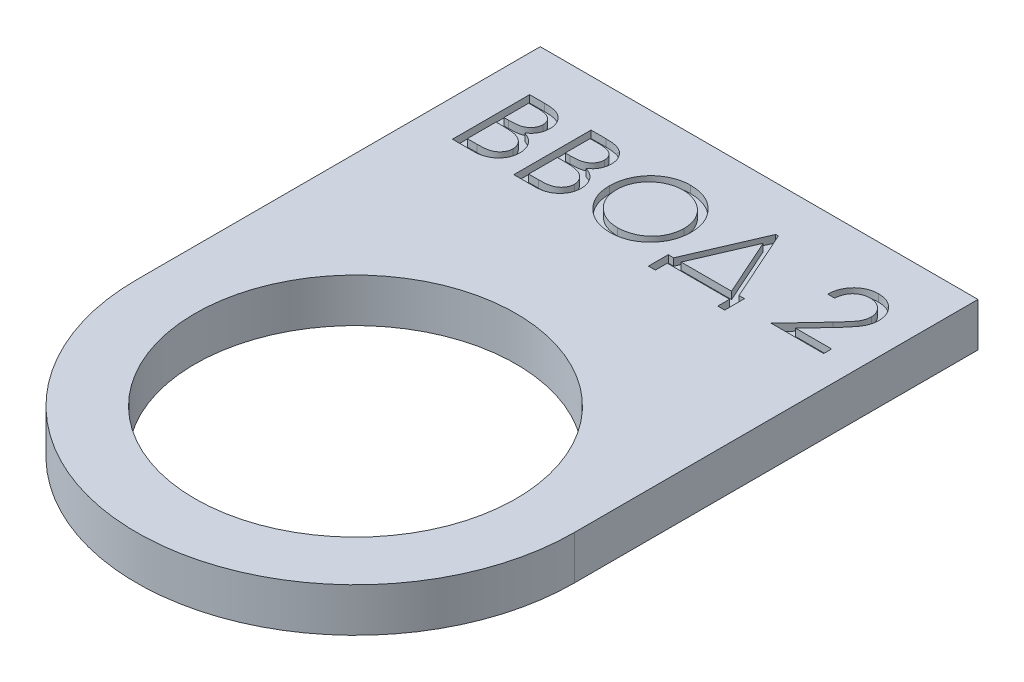
from build123d import *

# Parameters (mm, degrees)
SKETCH1_R           = 11
BOSS_EXTRUDE1_DEPTH = 1.5
CUT_EXTRUDE1_DEPTH  = 0.5


with BuildPart() as part:
    # Sketch1 → Boss-Extrude1 (new, symmetric)
    with BuildSketch(Plane(origin=(0, 0, 0), x_dir=(1, 0, 0), z_dir=(0, 1, 0))):
        with BuildLine():
            Line((15, 17.5), (-15, 17.5))
            Line((-15, 17.5), (-15, -10.16226942))
            ThreePointArc((-15, -10.16226942), (0, -25.16226942), (15, -10.16226942))
            Line((15, -10.16226942), (15, 17.5))
        make_face()
        with Locations(Location((0, -10.16226942, 0), (0, 0, 270))):
            Circle(SKETCH1_R, mode=Mode.SUBTRACT)
    extrude(amount=BOSS_EXTRUDE1_DEPTH, both=True)

    # Sketch2 → Cut-Extrude1 (cut)
    # profile 1 of 5: a face of its own
    with BuildSketch(Plane(origin=(0, 1.5, 0), x_dir=(1, 0, 0), z_dir=(0, 1, 0))):
        with BuildLine():
            Line((10.00667735, 12.663461538), (9.531784188, 12.663461538))
            add(Edge.make_bspline(
                [(9.531784188, 12.663461538), (9.534879288, 12.726463952), (9.540957983, 12.850199016), (9.569424563, 13.030605398), (9.610156604, 13.203045391), (9.667747255, 13.366134428), (9.739269841, 13.521314529), (9.82504024, 13.667969315), (9.926630942, 13.805539327), (10.041848266, 13.932749244), (10.166986566, 14.0494495), (10.302008641, 14.150225879), (10.443893385, 14.235372835), (10.592210333, 14.306555188), (10.748632852, 14.35998567), (10.911741458, 14.399630292), (11.082252772, 14.423482624), (11.198427567, 14.42604649), (11.257512019, 14.427350427)],
                knots=[0, 0, 0, 0, 1.10065271, 2.161652631, 3.183658789, 4.190468796, 5.17591951, 6.163126047, 7.15150782, 8.156236427, 9.156009102, 10.134482811, 11.092018607, 12.041330605, 13.001268258, 13.972401359, 14.968799086, 16, 16, 16, 16], degree=3))
            add(Edge.make_bspline(
                [(11.257512019, 14.427350427), (11.315536012, 14.425992047), (11.429551086, 14.423322877), (11.595954369, 14.400400845), (11.75436766, 14.364499772), (11.904481307, 14.314130035), (12.045097619, 14.246420246), (12.177272936, 14.165083492), (12.302580829, 14.071013032), (12.41537918, 13.960260243), (12.518956871, 13.842025685), (12.608313852, 13.715799926), (12.684836135, 13.585429459), (12.748619889, 13.449920154), (12.795573814, 13.307996099), (12.831221819, 13.161723542), (12.851371599, 13.009588411), (12.854464084, 12.906617786), (12.856036325, 12.854266827)],
                knots=[0, 0, 0, 0, 1.111607364, 2.184268762, 3.212621178, 4.221274766, 5.211760367, 6.196651075, 7.1921475, 8.207485113, 9.220403448, 10.201281604, 11.166441695, 12.114753415, 13.065576456, 14.026450734, 14.996634279, 16, 16, 16, 16], degree=3))
            add(Edge.make_bspline(
                [(12.856036325, 12.854266827), (12.853476273, 12.780564744), (12.848401094, 12.634453944), (12.804987691, 12.419740997), (12.737184037, 12.211712852), (12.655545176, 12.044288597), (12.573188029, 11.909376053), (12.498972392, 11.798298368), (12.412091071, 11.678698434), (12.311279532, 11.550976745), (12.198623166, 11.414132877), (12.073101562, 11.268249496), (11.933819631, 11.114833844), (11.836062135, 11.010050375), (11.785406651, 10.955754207)],
                knots=[0, 0, 0, 0, 1.184426356, 2.348067706, 3.509069118, 4.696110526, 5.333549288, 6.050745305, 6.844228056, 7.710549037, 8.667450064, 9.695053472, 10.805634456, 12, 12, 12, 12], degree=3))
            Line((11.785406651, 10.955754207), (10.461429955, 9.542735043))
            Line((10.461429955, 9.542735043), (12.923878205, 9.542735043))
            Line((12.923878205, 9.542735043), (12.923878205, 9))
            Line((12.923878205, 9), (9.328258547, 9))
            Line((9.328258547, 9), (11.380475427, 11.1900207))
            add(Edge.make_bspline(
                [(11.380475427, 11.1900207), (11.430440685, 11.242178854), (11.526413719, 11.342363993), (11.662156424, 11.488630135), (11.784074894, 11.624322893), (11.892958334, 11.749185889), (11.986444705, 11.865045521), (12.069406294, 11.968149418), (12.13587808, 12.063028171), (12.208019214, 12.173005051), (12.277890352, 12.307280816), (12.337931653, 12.471373418), (12.374542197, 12.640294383), (12.378934032, 12.754446273), (12.381143162, 12.811865652)],
                knots=[0, 0, 0, 0, 1.329631726, 2.553950428, 3.673215718, 4.687767853, 5.603093632, 6.413772471, 7.123043292, 7.734684054, 8.834405432, 9.900288307, 10.943827018, 12, 12, 12, 12], degree=3))
            add(Edge.make_bspline(
                [(12.381143162, 12.811865652), (12.380181981, 12.847972052), (12.378287676, 12.919130833), (12.36156949, 13.023460968), (12.336304797, 13.124100627), (12.300101847, 13.221359373), (12.252315466, 13.314259347), (12.19414738, 13.402913632), (12.127033831, 13.488621949), (12.049395603, 13.568984673), (11.964106757, 13.64258602), (11.874005928, 13.70778553), (11.778680175, 13.762273233), (11.678531419, 13.806940187), (11.573838864, 13.841979156), (11.464400023, 13.866258199), (11.350517284, 13.881501954), (11.272754737, 13.883564452), (11.233131343, 13.884615385)],
                knots=[0, 0, 0, 0, 0.991446411, 1.95395049, 2.89581595, 3.838931463, 4.798493298, 5.75982156, 6.748411868, 7.785213223, 8.824556874, 9.840280684, 10.836137867, 11.835679398, 12.848801643, 13.863922112, 14.911575587, 16, 16, 16, 16], degree=3))
            add(Edge.make_bspline(
                [(11.233131343, 13.884615385), (11.191749251, 13.883534324), (11.110481654, 13.881411299), (10.991163593, 13.866560367), (10.877338667, 13.84093987), (10.768720552, 13.805898946), (10.665125464, 13.761360425), (10.567057207, 13.705886002), (10.474735934, 13.63968953), (10.387988095, 13.564637737), (10.308062793, 13.481078387), (10.23783954, 13.387929991), (10.176480376, 13.286893303), (10.122944988, 13.178240947), (10.079469123, 13.060987018), (10.046247812, 12.93554775), (10.019960556, 12.802467804), (10.011178626, 12.710566545), (10.00667735, 12.663461538)],
                knots=[0, 0, 0, 0, 1.031018746, 2.02475058, 2.990194455, 3.934040569, 4.864654155, 5.795059489, 6.735614925, 7.690564532, 8.649604399, 9.611025574, 10.590972636, 11.591080095, 12.624614302, 13.701020113, 14.821632451, 16, 16, 16, 16], degree=3))
        make_face()
    # profile 2 of 5: a face of its own
    with BuildSketch(Plane(origin=(0, 1.5, 0), x_dir=(1, 0, 0), z_dir=(0, 1, 0))):
        Polygon((2.204861111, 8.185897436), (1.729967949, 8.185897436), (1.729967949, 9.542735043), (2.103098291, 9.542735043), (4.211496728, 14.427350427), (4.393821782, 14.427350427), (6.580662393, 9.542735043), (6.953792735, 9.542735043), (6.953792735, 8.185897436), (6.478899573, 8.185897436), (6.478899573, 9), (2.204861111, 9), align=None)
        Polygon((2.612972423, 9.542735043), (6.067608173, 9.542735043), (4.307959402, 13.472263956), align=None, mode=Mode.SUBTRACT)
    # profile 3 of 5: a face of its own
    with BuildSketch(Plane(origin=(0, 1.5, 0), x_dir=(1, 0, 0), z_dir=(0, 1, 0))):
        with BuildLine():
            add(Edge.make_bspline(
                [(-1.628205128, 14.427350427), (-1.530221444, 14.424868667), (-1.337773405, 14.419994285), (-1.054933976, 14.38268183), (-0.784915201, 14.318130467), (-0.525517491, 14.232159053), (-0.279843586, 14.117474446), (-0.046044308, 13.978855234), (0.17532406, 13.81484916), (0.381277816, 13.626724019), (0.569747253, 13.42203713), (0.735793533, 13.20360029), (0.874952715, 12.972734244), (0.989231227, 12.73013275), (1.078885077, 12.476344465), (1.140750774, 12.210016389), (1.180269168, 11.932874132), (1.184889212, 11.74384542), (1.187232906, 11.647953392)],
                knots=[0, 0, 0, 0, 1.065120563, 2.091984664, 3.0946048, 4.079830382, 5.057816894, 6.036188127, 7.030412546, 8.04752943, 9.064399622, 10.05169764, 11.02544977, 11.989514704, 12.962713494, 13.945757189, 14.957906945, 16, 16, 16, 16], degree=3))
            add(Edge.make_bspline(
                [(1.187232906, 11.647953392), (1.184889556, 11.552767729), (1.180270541, 11.36514576), (1.140705841, 11.08976222), (1.078655758, 10.825041762), (0.990063784, 10.571426311), (0.876330025, 10.328648327), (0.73624423, 10.097346623), (0.571233114, 9.87744537), (0.383444185, 9.671353602), (0.178730705, 9.482369331), (-0.040843627, 9.317694364), (-0.270340671, 9.175992414), (-0.512713682, 9.062926621), (-0.764748261, 8.97255717), (-1.028700107, 8.910943074), (-1.303332397, 8.871199569), (-1.490613557, 8.86663586), (-1.585803953, 8.864316239)],
                knots=[0, 0, 0, 0, 1.043624062, 2.057103931, 3.04512605, 4.022047818, 4.998200453, 5.980619268, 6.982898556, 8.009068085, 9.034988726, 10.034168286, 11.015286542, 11.987931943, 12.962482838, 13.94673481, 14.956375938, 16, 16, 16, 16], degree=3))
            add(Edge.make_bspline(
                [(-1.585803953, 8.864316239), (-1.681695483, 8.866658765), (-1.870723214, 8.871276506), (-2.148213732, 8.910860296), (-2.414728892, 8.972759649), (-2.669506542, 9.061220344), (-2.912688757, 9.175546395), (-3.144751144, 9.314950635), (-3.364762236, 9.480363812), (-3.570897972, 9.668091848), (-3.759506878, 9.872458361), (-3.923940696, 10.091433961), (-4.063376284, 10.320722568), (-4.177318466, 10.560960491), (-4.267525446, 10.810986363), (-4.329067254, 11.07246799), (-4.368884706, 11.343914624), (-4.373473104, 11.528734244), (-4.375801282, 11.622512687)],
                knots=[0, 0, 0, 0, 1.053102029, 2.075944431, 3.073151272, 4.055350789, 5.033113405, 6.020478099, 7.024410459, 8.052272461, 9.079885166, 10.07527673, 11.055994387, 12.023226415, 12.992069828, 13.970394897, 14.97016774, 16, 16, 16, 16], degree=3))
            add(Edge.make_bspline(
                [(-4.375801282, 11.622512687), (-4.374992964, 11.685457318), (-4.373386525, 11.810552504), (-4.354046705, 11.996315102), (-4.32598318, 12.179090263), (-4.285763622, 12.358358244), (-4.233161935, 12.533680209), (-4.171095179, 12.706265291), (-4.095288508, 12.874364493), (-4.009592767, 13.038774144), (-3.913946938, 13.196931335), (-3.80830146, 13.346427848), (-3.696367033, 13.488518164), (-3.573655712, 13.619520182), (-3.444211801, 13.743244877), (-3.305935443, 13.85779089), (-3.159670384, 13.964191113), (-3.004787262, 14.060076629), (-2.845102489, 14.146798177), (-2.68049117, 14.221216928), (-2.513188973, 14.28508895), (-2.342412303, 14.336857817), (-2.168614659, 14.377727681), (-1.991416723, 14.405557846), (-1.810959662, 14.424946994), (-1.689385406, 14.426545836), (-1.628205128, 14.427350427)],
                knots=[0, 0, 0, 0, 1.037015668, 2.060948919, 3.074880161, 4.083647147, 5.086022904, 6.090072063, 7.104153813, 8.122640571, 9.144368836, 10.147691507, 11.138137339, 12.123020368, 13.103399296, 14.087645067, 15.080126199, 16.082011238, 17.087798457, 18.072939717, 19.057185487, 20.037253025, 21.01195951, 21.997135196, 22.992090687, 24, 24, 24, 24], degree=3))
        make_face()
        with BuildLine():
            add(Edge.make_bspline(
                [(-1.604884482, 13.884615385), (-1.655101844, 13.884003229), (-1.755056488, 13.88278477), (-1.903653347, 13.866734819), (-2.050295913, 13.843859868), (-2.195014473, 13.811230664), (-2.337203506, 13.766774537), (-2.478188384, 13.715610307), (-2.616683478, 13.653287943), (-2.752231572, 13.58287445), (-2.883638888, 13.504937391), (-3.007634282, 13.418801505), (-3.124538756, 13.326486786), (-3.234066076, 13.227777794), (-3.335894634, 13.122171848), (-3.432028647, 13.011269951), (-3.5186148, 12.891902211), (-3.597967993, 12.767305524), (-3.668978895, 12.637642181), (-3.732124133, 12.504277271), (-3.783776861, 12.366122911), (-3.82590212, 12.224677934), (-3.860826834, 12.080166359), (-3.882951934, 11.93149192), (-3.899178239, 11.779401692), (-3.900327053, 11.676619603), (-3.90090812, 11.624632746)],
                knots=[0, 0, 0, 0, 1.008559885, 2.007477868, 2.99961109, 3.989939068, 4.984837346, 5.991145699, 7.001802488, 8.033829008, 9.059044045, 10.069351652, 11.065060232, 12.050310815, 13.029377138, 14.011219647, 14.996725999, 15.989392538, 16.977580475, 17.965360261, 18.951710183, 19.937753436, 20.929683414, 21.935841486, 22.955955122, 24, 24, 24, 24], degree=3))
            add(Edge.make_bspline(
                [(-3.90090812, 11.624632746), (-3.89898065, 11.548187483), (-3.89518872, 11.397796003), (-3.861990965, 11.177408452), (-3.810855361, 10.965608305), (-3.735475772, 10.763554466), (-3.64120758, 10.569510134), (-3.524750258, 10.38519669), (-3.386775212, 10.21056432), (-3.230045833, 10.046832187), (-3.058712693, 9.897386745), (-2.876781065, 9.766208734), (-2.686200016, 9.655219428), (-2.486472555, 9.564799854), (-2.278664966, 9.493151084), (-2.061438192, 9.444046487), (-1.836239283, 9.411728834), (-1.682734602, 9.408625263), (-1.604884482, 9.407051282)],
                knots=[0, 0, 0, 0, 1.032063989, 2.030389145, 3.003944642, 3.970395727, 4.937377036, 5.913328081, 6.909231446, 7.93887556, 8.970685674, 9.976071282, 10.964166581, 11.944589148, 12.933237628, 13.927779006, 14.949070134, 16, 16, 16, 16], degree=3))
            add(Edge.make_bspline(
                [(-1.604884482, 9.407051282), (-1.552558212, 9.407770199), (-1.448779502, 9.409196028), (-1.294420795, 9.423557123), (-1.142842951, 9.446586259), (-0.994258576, 9.479743322), (-0.848836302, 9.521240884), (-0.705969159, 9.570540663), (-0.567178886, 9.632046768), (-0.430714608, 9.70000379), (-0.300091719, 9.777474029), (-0.175396569, 9.860686469), (-0.059772171, 9.952865217), (0.049673211, 10.050107624), (0.151919836, 10.154374394), (0.246276277, 10.265529968), (0.33242481, 10.384275961), (0.411747871, 10.508683658), (0.482509947, 10.638701802), (0.544164061, 10.772550244), (0.596470093, 10.909899397), (0.638695332, 11.050947368), (0.671784066, 11.195426271), (0.694583469, 11.343529556), (0.710531703, 11.494960942), (0.711733784, 11.597383201), (0.712339744, 11.649013421)],
                knots=[0, 0, 0, 0, 1.047197238, 2.076906641, 3.100256066, 4.114471768, 5.12198147, 6.126382909, 7.136867548, 8.15857795, 9.17633901, 10.174870724, 11.156907918, 12.133735059, 13.104061851, 14.077631395, 15.04955518, 16.038496417, 17.029181396, 18.010275684, 18.986308667, 19.968651475, 20.955262928, 21.950658345, 22.966943676, 24, 24, 24, 24], degree=3))
            add(Edge.make_bspline(
                [(0.712339744, 11.649013421), (0.711733299, 11.700290434), (0.710530304, 11.802007834), (0.694591087, 11.952383118), (0.671759979, 12.099420712), (0.638856837, 12.242543367), (0.596447676, 12.381787565), (0.544154926, 12.517022529), (0.482491438, 12.648752062), (0.41172186, 12.776650582), (0.332171746, 12.899379055), (0.245245926, 13.016706512), (0.149443555, 13.126429586), (0.047501826, 13.23125704), (-0.063125584, 13.328953135), (-0.181937552, 13.419550279), (-0.307491684, 13.505234872), (-0.44042929, 13.582531853), (-0.577625506, 13.653915276), (-0.718404942, 13.71507334), (-0.861172747, 13.767040711), (-1.00556587, 13.81136517), (-1.152799658, 13.843732073), (-1.301879257, 13.866755434), (-1.452598409, 13.882779184), (-1.553961373, 13.884001375), (-1.604884482, 13.884615385)],
                knots=[0, 0, 0, 0, 1.02996197, 2.043119294, 3.035359645, 4.018872909, 4.991431989, 5.957985074, 6.929999688, 7.912076566, 8.892894881, 9.867085534, 10.843653904, 11.817741046, 12.803660682, 13.806313499, 14.818574707, 15.856120519, 16.894564902, 17.924820532, 18.937903209, 19.946497019, 20.957711757, 21.963978472, 22.977135795, 24, 24, 24, 24], degree=3))
        make_face(mode=Mode.SUBTRACT)
    # profile 4 of 5: a face of its own
    with BuildSketch(Plane(origin=(0, 1.5, 0), x_dir=(1, 0, 0), z_dir=(0, 1, 0))):
        with BuildLine():
            Line((-8.310630342, 14.291666667), (-7.278161725, 14.291666667))
            add(Edge.make_bspline(
                [(-7.278161725, 14.291666667), (-7.22762105, 14.291400949), (-7.129660643, 14.290885921), (-6.98720982, 14.28289833), (-6.853786023, 14.272007068), (-6.729350558, 14.254725856), (-6.613960924, 14.233874002), (-6.507269377, 14.208622447), (-6.409615188, 14.178344115), (-6.293028075, 14.13019557), (-6.160100409, 14.058647447), (-6.016169506, 13.952922116), (-5.893094049, 13.823605178), (-5.786979022, 13.677732592), (-5.702613043, 13.517265413), (-5.64157851, 13.346028306), (-5.602937437, 13.166229958), (-5.598963495, 13.042793249), (-5.596955128, 12.980410323)],
                knots=[0, 0, 0, 0, 1.001505555, 1.941167018, 2.826882275, 3.653841531, 4.429895133, 5.150066043, 5.825578002, 6.45369114, 7.647487171, 8.808567382, 9.977351308, 11.170798116, 12.373658725, 13.556498008, 14.765093433, 16, 16, 16, 16], degree=3))
            add(Edge.make_bspline(
                [(-5.596955128, 12.980410323), (-5.59860797, 12.92197134), (-5.601855961, 12.807133228), (-5.632914657, 12.639169515), (-5.681538525, 12.479283743), (-5.749128604, 12.328059423), (-5.836973288, 12.188913365), (-5.941080508, 12.060723093), (-6.066684722, 11.948916138), (-6.160790572, 11.886409607), (-6.208592081, 11.854659121)],
                knots=[0, 0, 0, 0, 1.044552857, 2.05264487, 3.044412934, 4.028983338, 5.005914585, 5.980388656, 6.974128949, 8, 8, 8, 8], degree=3))
            add(Edge.make_bspline(
                [(-6.208592081, 11.854659121), (-6.148478101, 11.831579897), (-6.033465166, 11.787423623), (-5.875189885, 11.709355719), (-5.73882387, 11.624443957), (-5.623318661, 11.531716041), (-5.524534349, 11.431765815), (-5.438275735, 11.323127725), (-5.364674134, 11.204384603), (-5.301608166, 11.076774496), (-5.252397547, 10.941600431), (-5.215543501, 10.800130329), (-5.194426048, 10.652871478), (-5.191420924, 10.552654297), (-5.189903846, 10.502061632)],
                knots=[0, 0, 0, 0, 1.27268992, 2.434971085, 3.483601985, 4.442670788, 5.356604649, 6.2567628, 7.179492994, 8.113709626, 9.066344395, 10.018646069, 10.999752585, 12, 12, 12, 12], degree=3))
            add(Edge.make_bspline(
                [(-5.189903846, 10.502061632), (-5.191380744, 10.450404575), (-5.194286583, 10.348767869), (-5.21572535, 10.199459511), (-5.252024833, 10.05677358), (-5.302025257, 9.919787173), (-5.367282566, 9.788765303), (-5.446699845, 9.663559534), (-5.541392804, 9.545427868), (-5.647321189, 9.433057628), (-5.767158005, 9.332020378), (-5.896449682, 9.242038298), (-6.036824475, 9.168036514), (-6.185976894, 9.105873005), (-6.345580087, 9.058388312), (-6.514917362, 9.025167873), (-6.693842676, 9.002784067), (-6.816624085, 9.000943769), (-6.879590678, 9)],
                knots=[0, 0, 0, 0, 0.978564426, 1.925352924, 2.850884081, 3.763762016, 4.682927383, 5.618979971, 6.567305752, 7.547517671, 8.540179244, 9.531824382, 10.526200242, 11.540722885, 12.589160233, 13.674978461, 14.80764778, 16, 16, 16, 16], degree=3))
            Line((-6.879590678, 9), (-8.310630342, 9))
            Line((-8.310630342, 9), (-8.310630342, 14.291666667))
        make_face()
        with BuildLine():
            Line((-7.835737179, 13.748931624), (-7.835737179, 12.052884615))
            Line((-7.835737179, 12.052884615), (-7.516668336, 12.052884615))
            add(Edge.make_bspline(
                [(-7.516668336, 12.052884615), (-7.470027895, 12.053489261), (-7.379909059, 12.054657559), (-7.249401597, 12.058004186), (-7.1282602, 12.067375038), (-7.016693976, 12.076743196), (-6.914878615, 12.091975013), (-6.823039681, 12.11010596), (-6.73973585, 12.129281305), (-6.643670109, 12.161892315), (-6.534702675, 12.210088324), (-6.418538339, 12.284885029), (-6.316130271, 12.373973039), (-6.229653571, 12.476768898), (-6.158879086, 12.58995944), (-6.109721445, 12.711738653), (-6.076388051, 12.839071471), (-6.073377045, 12.926487163), (-6.071848291, 12.970870059)],
                knots=[0, 0, 0, 0, 1.156816544, 2.235205308, 3.236616184, 4.169592532, 5.011045266, 5.787822928, 6.49130361, 7.128639758, 8.301311294, 9.436451833, 10.541879658, 11.654887649, 12.756523258, 13.837046038, 14.901820046, 16, 16, 16, 16], degree=3))
            add(Edge.make_bspline(
                [(-6.071848291, 12.970870059), (-6.072643825, 13.000239975), (-6.074204352, 13.057852274), (-6.086984941, 13.141837607), (-6.108707345, 13.220825185), (-6.136608479, 13.295897471), (-6.17559852, 13.364707054), (-6.221505185, 13.429633076), (-6.276970455, 13.488464493), (-6.340103535, 13.543451711), (-6.412688, 13.592202366), (-6.494680548, 13.63489971), (-6.587190489, 13.669281599), (-6.688658734, 13.699392924), (-6.800647164, 13.720541893), (-6.921863453, 13.738160705), (-7.053300468, 13.747130446), (-7.144234135, 13.74831784), (-7.191239316, 13.748931624)],
                knots=[0, 0, 0, 0, 0.91205012, 1.789085906, 2.630437955, 3.453916878, 4.269457761, 5.079663411, 5.91843418, 6.774407191, 7.675494373, 8.627863946, 9.638891023, 10.736472738, 11.911756761, 13.175263542, 14.539845004, 16, 16, 16, 16], degree=3))
            Line((-7.191239316, 13.748931624), (-7.835737179, 13.748931624))
        make_face(mode=Mode.SUBTRACT)
        with BuildLine():
            Line((-7.835737179, 11.510149573), (-7.835737179, 9.542735043))
            Line((-7.835737179, 9.542735043), (-7.159438435, 9.542735043))
            add(Edge.make_bspline(
                [(-7.159438435, 9.542735043), (-7.111028868, 9.543315232), (-7.017725811, 9.544433471), (-6.883013237, 9.548084048), (-6.758155449, 9.556387845), (-6.643722196, 9.569459547), (-6.538477821, 9.583638869), (-6.443684865, 9.602705924), (-6.358574918, 9.624551377), (-6.259886381, 9.658318518), (-6.148756077, 9.710776277), (-6.028996806, 9.789870406), (-5.922519072, 9.884097311), (-5.832099215, 9.993152384), (-5.757996245, 10.111733081), (-5.704088592, 10.237440931), (-5.670840511, 10.368198812), (-5.666815565, 10.457350865), (-5.664797009, 10.502061632)],
                knots=[0, 0, 0, 0, 1.160039823, 2.235823828, 3.228722157, 4.157150951, 4.99529583, 5.772374946, 6.472645482, 7.099169577, 8.269452708, 9.405989375, 10.527446681, 11.663510218, 12.788923519, 13.866172445, 14.929861265, 16, 16, 16, 16], degree=3))
            add(Edge.make_bspline(
                [(-5.664797009, 10.502061632), (-5.665214452, 10.530021802), (-5.666042606, 10.585491141), (-5.678531869, 10.667006724), (-5.696695696, 10.745967271), (-5.720177744, 10.822587188), (-5.754376224, 10.895481221), (-5.794300406, 10.966091044), (-5.841111096, 11.034509995), (-5.91405168, 11.121009473), (-6.020145038, 11.220669719), (-6.170892186, 11.318244276), (-6.342300304, 11.396935603), (-6.466620442, 11.430347907), (-6.530841012, 11.447607839)],
                knots=[0, 0, 0, 0, 0.723448775, 1.435228256, 2.130040452, 2.821711965, 3.505591119, 4.210454504, 4.921174351, 5.648778258, 7.137944449, 8.670945889, 10.280296675, 12, 12, 12, 12], degree=3))
            add(Edge.make_bspline(
                [(-6.530841012, 11.447607839), (-6.556587383, 11.452831597), (-6.612410827, 11.464157782), (-6.703438954, 11.476113476), (-6.807361042, 11.486764936), (-6.924417058, 11.49464371), (-7.054755104, 11.502787651), (-7.19865354, 11.505954821), (-7.355524719, 11.509733464), (-7.464370329, 11.510007322), (-7.520908454, 11.510149573)],
                knots=[0, 0, 0, 0, 0.634451884, 1.375622551, 2.216452059, 3.157844607, 4.20941857, 5.370758133, 6.634282058, 8, 8, 8, 8], degree=3))
            Line((-7.520908454, 11.510149573), (-7.835737179, 11.510149573))
        make_face(mode=Mode.SUBTRACT)
    # profile 5 of 5: a face of its own
    with BuildSketch(Plane(origin=(0, 1.5, 0), x_dir=(1, 0, 0), z_dir=(0, 1, 0))):
        with BuildLine():
            Line((-12.516826923, 14.291666667), (-11.484358307, 14.291666667))
            add(Edge.make_bspline(
                [(-11.484358307, 14.291666667), (-11.433817631, 14.291400949), (-11.335857224, 14.290885921), (-11.193406401, 14.28289833), (-11.059982604, 14.272007068), (-10.935547139, 14.254725856), (-10.820157505, 14.233874002), (-10.713465959, 14.208622447), (-10.61581177, 14.178344115), (-10.499224656, 14.13019557), (-10.36629699, 14.058647447), (-10.222366087, 13.952922116), (-10.09929063, 13.823605178), (-9.993175603, 13.677732592), (-9.908809624, 13.517265413), (-9.847775091, 13.346028306), (-9.809134018, 13.166229958), (-9.805160076, 13.042793249), (-9.803151709, 12.980410323)],
                knots=[0, 0, 0, 0, 1.001505555, 1.941167018, 2.826882275, 3.653841531, 4.429895133, 5.150066043, 5.825578002, 6.45369114, 7.647487171, 8.808567382, 9.977351308, 11.170798116, 12.373658725, 13.556498008, 14.765093433, 16, 16, 16, 16], degree=3))
            add(Edge.make_bspline(
                [(-9.803151709, 12.980410323), (-9.804804552, 12.92197134), (-9.808052542, 12.807133228), (-9.839111238, 12.639169515), (-9.887735106, 12.479283743), (-9.955325185, 12.328059423), (-10.04316987, 12.188913365), (-10.147277089, 12.060723093), (-10.272881303, 11.948916138), (-10.366987154, 11.886409607), (-10.414788662, 11.854659121)],
                knots=[0, 0, 0, 0, 1.044552857, 2.05264487, 3.044412934, 4.028983338, 5.005914585, 5.980388656, 6.974128949, 8, 8, 8, 8], degree=3))
            add(Edge.make_bspline(
                [(-10.414788662, 11.854659121), (-10.354674682, 11.831579897), (-10.239661747, 11.787423623), (-10.081386467, 11.709355719), (-9.945020451, 11.624443957), (-9.829515242, 11.531716041), (-9.730730931, 11.431765815), (-9.644472317, 11.323127725), (-9.570870715, 11.204384603), (-9.507804747, 11.076774496), (-9.458594128, 10.941600431), (-9.421740082, 10.800130329), (-9.400622629, 10.652871478), (-9.397617505, 10.552654297), (-9.396100427, 10.502061632)],
                knots=[0, 0, 0, 0, 1.27268992, 2.434971085, 3.483601985, 4.442670788, 5.356604649, 6.2567628, 7.179492994, 8.113709626, 9.066344395, 10.018646069, 10.999752585, 12, 12, 12, 12], degree=3))
            add(Edge.make_bspline(
                [(-9.396100427, 10.502061632), (-9.397577326, 10.450404575), (-9.400483164, 10.348767869), (-9.421921931, 10.199459511), (-9.458221414, 10.05677358), (-9.508221838, 9.919787173), (-9.573479147, 9.788765303), (-9.652896426, 9.663559534), (-9.747589385, 9.545427868), (-9.853517771, 9.433057628), (-9.973354586, 9.332020378), (-10.102646263, 9.242038298), (-10.243021056, 9.168036514), (-10.392173476, 9.105873005), (-10.551776668, 9.058388312), (-10.721113943, 9.025167873), (-10.900039257, 9.002784067), (-11.022820666, 9.000943769), (-11.08578726, 9)],
                knots=[0, 0, 0, 0, 0.978564426, 1.925352924, 2.850884081, 3.763762016, 4.682927383, 5.618979971, 6.567305752, 7.547517671, 8.540179244, 9.531824382, 10.526200242, 11.540722885, 12.589160233, 13.674978461, 14.80764778, 16, 16, 16, 16], degree=3))
            Line((-11.08578726, 9), (-12.516826923, 9))
            Line((-12.516826923, 9), (-12.516826923, 14.291666667))
        make_face()
        with BuildLine():
            Line((-12.041933761, 13.748931624), (-12.041933761, 12.052884615))
            Line((-12.041933761, 12.052884615), (-11.722864917, 12.052884615))
            add(Edge.make_bspline(
                [(-11.722864917, 12.052884615), (-11.676224477, 12.053489261), (-11.586105641, 12.054657559), (-11.455598178, 12.058004186), (-11.334456781, 12.067375038), (-11.222890558, 12.076743196), (-11.121075196, 12.091975013), (-11.029236262, 12.11010596), (-10.945932431, 12.129281305), (-10.84986669, 12.161892315), (-10.740899256, 12.210088324), (-10.62473492, 12.284885029), (-10.522326853, 12.373973039), (-10.435850152, 12.476768898), (-10.365075667, 12.58995944), (-10.315918026, 12.711738653), (-10.282584632, 12.839071471), (-10.279573627, 12.926487163), (-10.278044872, 12.970870059)],
                knots=[0, 0, 0, 0, 1.156816544, 2.235205308, 3.236616184, 4.169592532, 5.011045266, 5.787822928, 6.49130361, 7.128639758, 8.301311294, 9.436451833, 10.541879658, 11.654887649, 12.756523258, 13.837046038, 14.901820046, 16, 16, 16, 16], degree=3))
            add(Edge.make_bspline(
                [(-10.278044872, 12.970870059), (-10.278840406, 13.000239975), (-10.280400934, 13.057852274), (-10.293181522, 13.141837607), (-10.314903926, 13.220825185), (-10.34280506, 13.295897471), (-10.381795101, 13.364707054), (-10.427701766, 13.429633076), (-10.483167036, 13.488464493), (-10.546300116, 13.543451711), (-10.618884581, 13.592202366), (-10.70087713, 13.63489971), (-10.79338707, 13.669281599), (-10.894855315, 13.699392924), (-11.006843745, 13.720541893), (-11.128060034, 13.738160705), (-11.25949705, 13.747130446), (-11.350430717, 13.74831784), (-11.397435897, 13.748931624)],
                knots=[0, 0, 0, 0, 0.91205012, 1.789085906, 2.630437955, 3.453916878, 4.269457761, 5.079663411, 5.91843418, 6.774407191, 7.675494373, 8.627863946, 9.638891023, 10.736472738, 11.911756761, 13.175263542, 14.539845004, 16, 16, 16, 16], degree=3))
            Line((-11.397435897, 13.748931624), (-12.041933761, 13.748931624))
        make_face(mode=Mode.SUBTRACT)
        with BuildLine():
            Line((-12.041933761, 11.510149573), (-12.041933761, 9.542735043))
            Line((-12.041933761, 9.542735043), (-11.365635016, 9.542735043))
            add(Edge.make_bspline(
                [(-11.365635016, 9.542735043), (-11.317225449, 9.543315232), (-11.223922392, 9.544433471), (-11.089209818, 9.548084048), (-10.96435203, 9.556387845), (-10.849918777, 9.569459547), (-10.744674402, 9.583638869), (-10.649881446, 9.602705924), (-10.564771499, 9.624551377), (-10.466082962, 9.658318518), (-10.354952658, 9.710776277), (-10.235193387, 9.789870406), (-10.128715653, 9.884097311), (-10.038295797, 9.993152384), (-9.964192826, 10.111733081), (-9.910285173, 10.237440931), (-9.877037092, 10.368198812), (-9.873012146, 10.457350865), (-9.87099359, 10.502061632)],
                knots=[0, 0, 0, 0, 1.160039823, 2.235823828, 3.228722157, 4.157150951, 4.99529583, 5.772374946, 6.472645482, 7.099169577, 8.269452708, 9.405989375, 10.527446681, 11.663510218, 12.788923519, 13.866172445, 14.929861265, 16, 16, 16, 16], degree=3))
            add(Edge.make_bspline(
                [(-9.87099359, 10.502061632), (-9.871411033, 10.530021802), (-9.872239187, 10.585491141), (-9.88472845, 10.667006724), (-9.902892277, 10.745967271), (-9.926374326, 10.822587188), (-9.960572806, 10.895481221), (-10.000496987, 10.966091044), (-10.047307677, 11.034509995), (-10.120248261, 11.121009473), (-10.226341619, 11.220669719), (-10.377088768, 11.318244276), (-10.548496885, 11.396935603), (-10.672817023, 11.430347907), (-10.737037593, 11.447607839)],
                knots=[0, 0, 0, 0, 0.723448775, 1.435228256, 2.130040452, 2.821711965, 3.505591119, 4.210454504, 4.921174351, 5.648778258, 7.137944449, 8.670945889, 10.280296675, 12, 12, 12, 12], degree=3))
            add(Edge.make_bspline(
                [(-10.737037593, 11.447607839), (-10.762783965, 11.452831597), (-10.818607408, 11.464157782), (-10.909635535, 11.476113476), (-11.013557623, 11.486764936), (-11.13061364, 11.49464371), (-11.260951685, 11.502787651), (-11.404850122, 11.505954821), (-11.5617213, 11.509733464), (-11.67056691, 11.510007322), (-11.727105035, 11.510149573)],
                knots=[0, 0, 0, 0, 0.634451884, 1.375622551, 2.216452059, 3.157844607, 4.20941857, 5.370758133, 6.634282058, 8, 8, 8, 8], degree=3))
            Line((-11.727105035, 11.510149573), (-12.041933761, 11.510149573))
        make_face(mode=Mode.SUBTRACT)
    extrude(amount=-CUT_EXTRUDE1_DEPTH, mode=Mode.SUBTRACT)


solid = part.part
